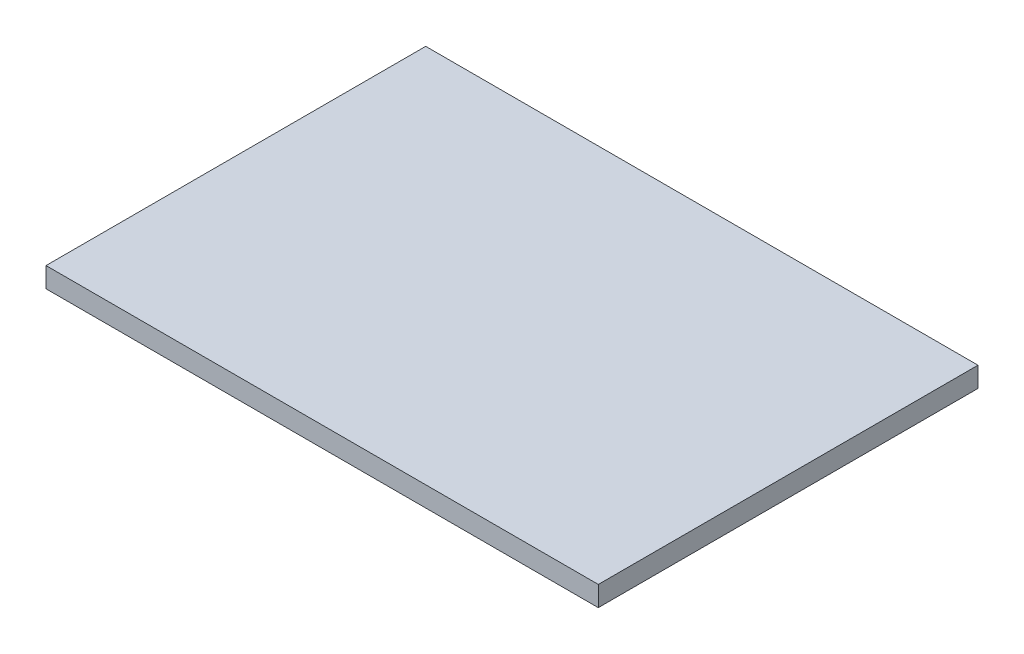
from build123d import *

# Parameters (mm, degrees)
SKETCH_1_W      = 9600
SKETCH_1_H      = 6600
EXTRUDE_1_DEPTH = 350


with BuildPart() as part:
    # Эскиз1 → Бобышка-Вытянуть1 (new body)
    with BuildSketch(Plane(origin=(0, 0, 0), x_dir=(1, 0, 0), z_dir=(0, 1, 0))):
        with Locations((-2414.285714286, -1103.571428571)):
            Rectangle(SKETCH_1_W, SKETCH_1_H)
    extrude(amount=EXTRUDE_1_DEPTH)


solid = part.part
